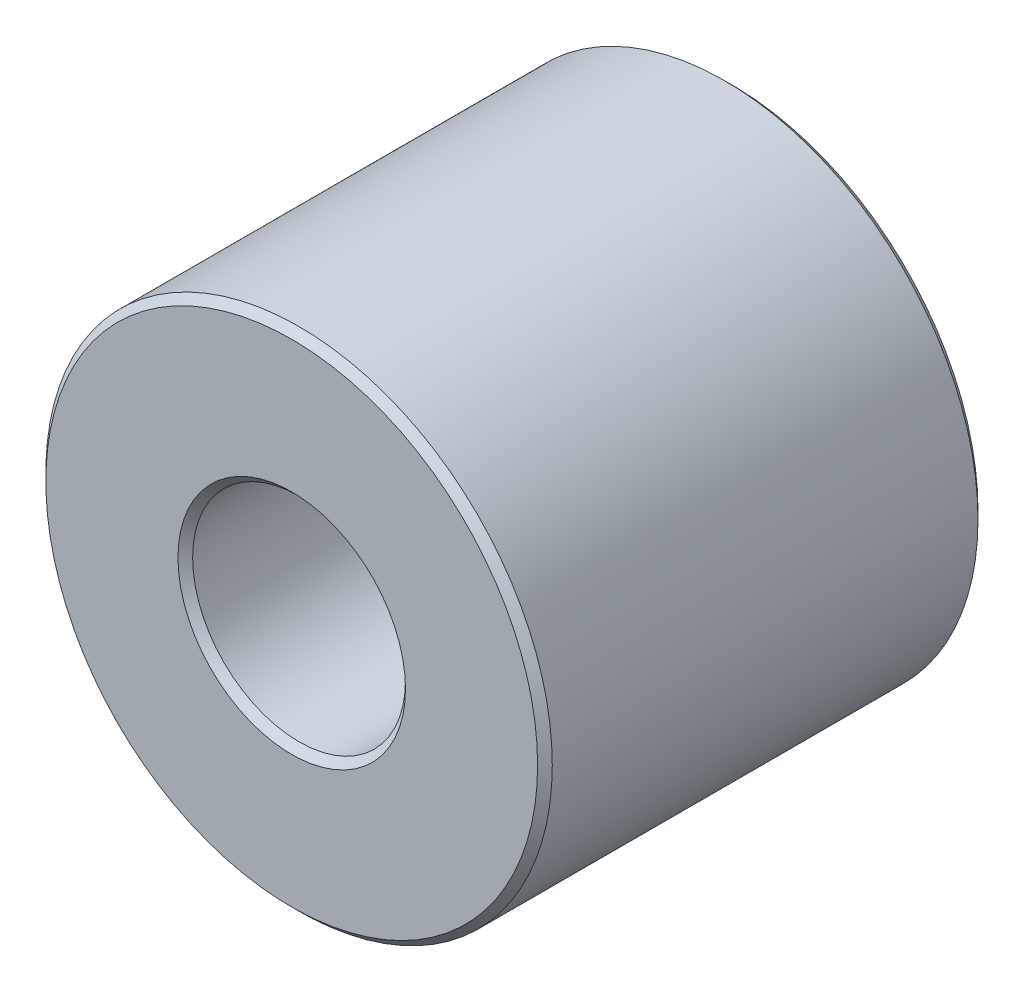
from build123d import *

# Parameters (mm, degrees)
SKETCH1_R           = 3.45
SKETCH1_R_2         = 1.45
BOSS_EXTRUDE1_DEPTH = 6
CHAMFER1_SIZE       = 0.1


with BuildPart() as part:
    # Sketch1 → Boss-Extrude1 (new body)
    with BuildSketch(Plane.XY):
        Circle(SKETCH1_R)
        Circle(SKETCH1_R_2, mode=Mode.SUBTRACT)
    extrude(amount=BOSS_EXTRUDE1_DEPTH)

    # Chamfer1
    chamfer1_edges = [part.edges().sort_by_distance(p)[0] for p in [
        (-3.45, 0, 0),
        (-3.45, 0, 6),
        (-1.45, 0, 0),
        (-1.45, 0, 6),
    ]]
    chamfer(chamfer1_edges, length=CHAMFER1_SIZE)


solid = part.part
